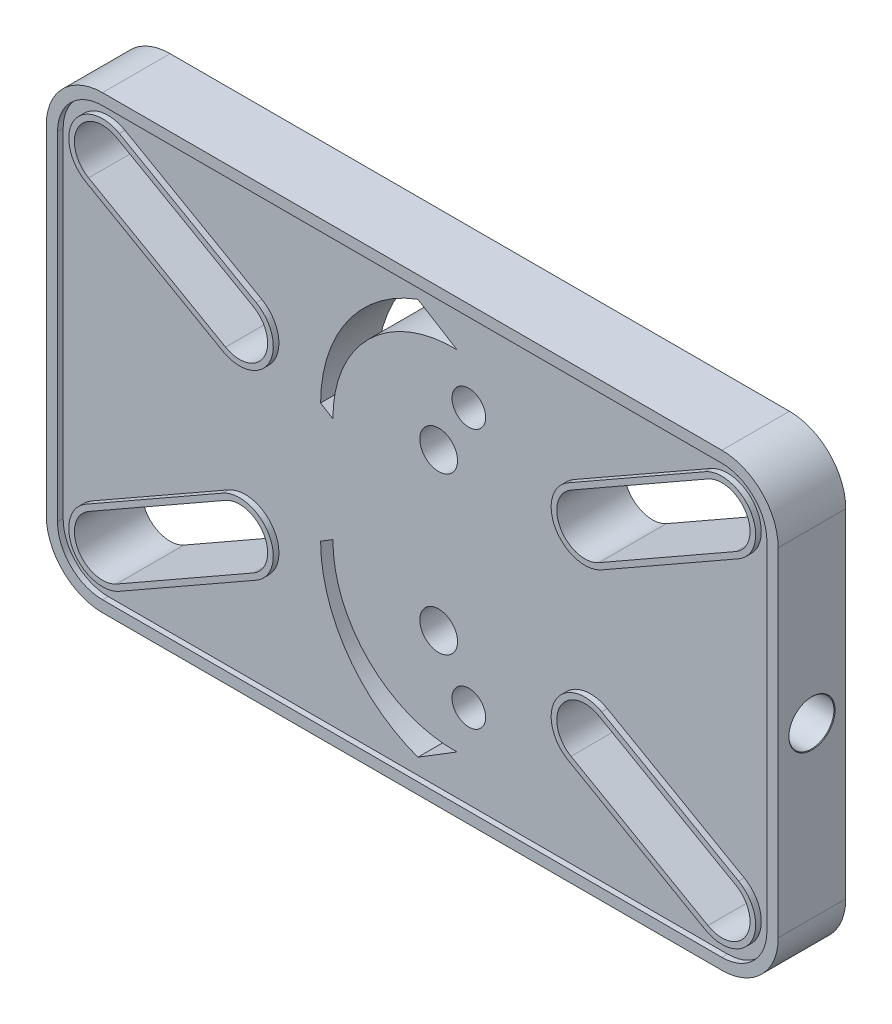
from build123d import *

# Parameters (mm, degrees)
BOSS_EXTRUDE2_DEPTH   = 3
BOSS_EXTRUDE2_2_DEPTH = 3
BOSS_EXTRUDE2_3_DEPTH = 3
BOSS_EXTRUDE2_4_DEPTH = 3
BOSS_EXTRUDE2_5_DEPTH = 3
SKETCH1_3_R           = 1.495691171
SKETCH1_3_R_2         = 1.676523608
BOSS_EXTRUDE3_DEPTH   = 2.5
SKETCH4_R             = 2
CUT_EXTRUDE5_DEPTH    = 69.0734897
CHAMFER1_SIZE         = 0.05


with BuildPart() as part:
    # Sketch1 → Boss-Extrude2 (new, symmetric)
    with BuildSketch(Plane.XY):
        with BuildLine():
            Line((27.5, 20), (-27.5, 20))
            ThreePointArc((-27.5, 20), (-31.035533906, 18.535533906), (-32.5, 15))
            Line((-32.5, 15), (-32.5, -15))
            ThreePointArc((-32.5, -15), (-31.035533906, -18.535533906), (-27.5, -20))
            Line((-27.5, -20), (27.5, -20))
            ThreePointArc((27.5, -20), (31.035533906, -18.535533906), (32.5, -15))
            Line((32.5, -15), (32.5, 15))
            ThreePointArc((32.5, 15), (31.035533906, 18.535533906), (27.5, 20))
        make_face()
        with BuildLine():
            Line((-31.5, -15), (-31.5, 15))
            ThreePointArc((-31.5, 15), (-30.328427125, 17.828427125), (-27.5, 19))
            Line((-27.5, 19), (27.5, 19))
            ThreePointArc((27.5, 19), (30.328427125, 17.828427125), (31.5, 15))
            Line((31.5, 15), (31.5, -15))
            ThreePointArc((31.5, -15), (30.328427125, -17.828427125), (27.5, -19))
            Line((27.5, -19), (-27.5, -19))
            ThreePointArc((-27.5, -19), (-30.328427125, -17.828427125), (-31.5, -15))
        make_face(mode=Mode.SUBTRACT)
    extrude(amount=BOSS_EXTRUDE2_DEPTH, both=True)



with BuildPart() as body_2:
    # Sketch1 → Boss-Extrude2 2 (new, symmetric)
    with BuildSketch(Plane.XY):
        with BuildLine():
            Line((-13.852089473, 10.671658719), (-26.014041324, 17.60613254))
            ThreePointArc((-26.014041324, 17.60613254), (-30.10613254, 16.485958676), (-28.985958676, 12.39386746))
            Line((-28.985958676, 12.39386746), (-16.824006824, 5.45939364))
            ThreePointArc((-16.824006824, 5.45939364), (-12.731915609, 6.579567504), (-13.852089473, 10.671658719))
        make_face()
        with BuildLine():
            ThreePointArc((-28.738298896, 12.828222884), (-29.671777116, 16.238298896), (-26.261701104, 17.171777116))
            Line((-26.261701104, 17.171777116), (-14.099749252, 10.237303296))
            ThreePointArc((-14.099749252, 10.237303296), (-13.166271032, 6.827227283), (-16.576347045, 5.893749063))
            Line((-16.576347045, 5.893749063), (-28.738298896, 12.828222884))
        make_face(mode=Mode.SUBTRACT)
    extrude(amount=BOSS_EXTRUDE2_2_DEPTH, both=True)


with BuildPart() as body_3:
    # Sketch1 → Boss-Extrude2 3 (new, symmetric)
    with BuildSketch(Plane.XY):
        with BuildLine():
            ThreePointArc((28.985958676, 12.39386746), (30.10613254, 16.485958676), (26.014041324, 17.60613254))
            Line((26.014041324, 17.60613254), (13.852089473, 10.671658719))
            ThreePointArc((13.852089473, 10.671658719), (12.731915609, 6.579567504), (16.824006824, 5.45939364))
            Line((16.824006824, 5.45939364), (28.985958676, 12.39386746))
        make_face()
        with BuildLine():
            Line((14.099749252, 10.237303296), (26.261701104, 17.171777116))
            ThreePointArc((26.261701104, 17.171777116), (29.671777116, 16.238298896), (28.738298896, 12.828222884))
            Line((28.738298896, 12.828222884), (16.576347045, 5.893749063))
            ThreePointArc((16.576347045, 5.893749063), (13.166271032, 6.827227283), (14.099749252, 10.237303296))
        make_face(mode=Mode.SUBTRACT)
    extrude(amount=BOSS_EXTRUDE2_3_DEPTH, both=True)


with BuildPart() as body_4:
    # Sketch1 → Boss-Extrude2 4 (new, symmetric)
    with BuildSketch(Plane.XY):
        with BuildLine():
            Line((13.852089473, -10.671658719), (26.014041324, -17.60613254))
            ThreePointArc((26.014041324, -17.60613254), (30.10613254, -16.485958676), (28.985958676, -12.39386746))
            Line((28.985958676, -12.39386746), (16.824006824, -5.45939364))
            ThreePointArc((16.824006824, -5.45939364), (12.731915609, -6.579567504), (13.852089473, -10.671658719))
        make_face()
        with BuildLine():
            ThreePointArc((28.738298896, -12.828222884), (29.671777116, -16.238298896), (26.261701104, -17.171777116))
            Line((26.261701104, -17.171777116), (14.099749252, -10.237303296))
            ThreePointArc((14.099749252, -10.237303296), (13.166271032, -6.827227283), (16.576347045, -5.893749063))
            Line((16.576347045, -5.893749063), (28.738298896, -12.828222884))
        make_face(mode=Mode.SUBTRACT)
    extrude(amount=BOSS_EXTRUDE2_4_DEPTH, both=True)


with BuildPart() as body_5:
    # Sketch1 → Boss-Extrude2 5 (new, symmetric)
    with BuildSketch(Plane.XY):
        with BuildLine():
            ThreePointArc((-28.985958676, -12.39386746), (-30.10613254, -16.485958676), (-26.014041324, -17.60613254))
            Line((-26.014041324, -17.60613254), (-13.852089473, -10.671658719))
            ThreePointArc((-13.852089473, -10.671658719), (-12.731915609, -6.579567504), (-16.824006824, -5.45939364))
            Line((-16.824006824, -5.45939364), (-28.985958676, -12.39386746))
        make_face()
        with BuildLine():
            Line((-14.099749252, -10.237303296), (-26.261701104, -17.171777116))
            ThreePointArc((-26.261701104, -17.171777116), (-29.671777116, -16.238298896), (-28.738298896, -12.828222884))
            Line((-28.738298896, -12.828222884), (-16.576347045, -5.893749063))
            ThreePointArc((-16.576347045, -5.893749063), (-13.166271032, -6.827227283), (-14.099749252, -10.237303296))
        make_face(mode=Mode.SUBTRACT)
    extrude(amount=BOSS_EXTRUDE2_5_DEPTH, both=True)


with BuildPart() as part_1:
    add(part.part)

    add(body_2.part)  # Boss-Extrude3 merges body 2

    add(body_3.part)  # Boss-Extrude3 merges body 3

    add(body_4.part)  # Boss-Extrude3 merges body 4

    add(body_5.part)  # Boss-Extrude3 merges body 5
    # Sketch1<3> → Boss-Extrude3 (add, symmetric)
    with BuildSketch(Plane.XY):
        with BuildLine():
            ThreePointArc((-27.5, 19), (-30.328427125, 17.828427125), (-31.5, 15))
            Line((-31.5, 15), (-31.5, -15))
            ThreePointArc((-31.5, -15), (-30.328427125, -17.828427125), (-27.5, -19))
            Line((-27.5, -19), (27.5, -19))
            ThreePointArc((27.5, -19), (30.328427125, -17.828427125), (31.5, -15))
            Line((31.5, -15), (31.5, 15))
            ThreePointArc((31.5, 15), (30.328427125, 17.828427125), (27.5, 19))
            Line((27.5, 19), (-27.5, 19))
        make_face()
        with BuildLine():
            Line((-13.852089473, -10.671658719), (-26.014041324, -17.60613254))
            ThreePointArc((-26.014041324, -17.60613254), (-30.10613254, -16.485958676), (-28.985958676, -12.39386746))
            Line((-28.985958676, -12.39386746), (-16.824006824, -5.45939364))
            ThreePointArc((-16.824006824, -5.45939364), (-12.731915609, -6.579567504), (-13.852089473, -10.671658719))
        make_face(mode=Mode.SUBTRACT)
        with BuildLine():
            ThreePointArc((0, -17.607662989), (-6.244508299, -12.814840409), (-8.638223432, -5.315829804))
            Line((-8.638223432, -5.315829804), (-7.540721224, -4.64044383))
            ThreePointArc((-7.540721224, -4.64044383), (-4.327491025, -12.392789568), (3.48180896, -15.465011321))
            Line((3.48180896, -15.465011321), (0, -17.607662989))
        make_face(mode=Mode.SUBTRACT)
        with Locations((4.527145443, -11.53276309)):
            Circle(SKETCH1_3_R, mode=Mode.SUBTRACT)
        with BuildLine():
            ThreePointArc((28.985958676, -12.39386746), (30.10613254, -16.485958676), (26.014041324, -17.60613254))
            Line((26.014041324, -17.60613254), (13.852089473, -10.671658719))
            ThreePointArc((13.852089473, -10.671658719), (12.731915609, -6.579567504), (16.824006824, -5.45939364))
            Line((16.824006824, -5.45939364), (28.985958676, -12.39386746))
        make_face(mode=Mode.SUBTRACT)
        with Locations((1.848455798, -6.957616723)):
            Circle(SKETCH1_3_R_2, mode=Mode.SUBTRACT)
        with BuildLine():
            ThreePointArc((-28.985958676, 12.39386746), (-30.10613254, 16.485958676), (-26.014041324, 17.60613254))
            Line((-26.014041324, 17.60613254), (-13.852089473, 10.671658719))
            ThreePointArc((-13.852089473, 10.671658719), (-12.731915609, 6.579567504), (-16.824006824, 5.45939364))
            Line((-16.824006824, 5.45939364), (-28.985958676, 12.39386746))
        make_face(mode=Mode.SUBTRACT)
        with BuildLine():
            Line((-7.540721224, 4.64044383), (-8.638223432, 5.315829804))
            ThreePointArc((-8.638223432, 5.315829804), (-6.244508299, 12.814840409), (0, 17.607662989))
            Line((0, 17.607662989), (3.48180896, 15.465011321))
            ThreePointArc((3.48180896, 15.465011321), (-4.327491025, 12.392789568), (-7.540721224, 4.64044383))
        make_face(mode=Mode.SUBTRACT)
        with Locations((1.848455798, 6.957616723)):
            Circle(SKETCH1_3_R_2, mode=Mode.SUBTRACT)
        with Locations((4.527145443, 11.53276309)):
            Circle(SKETCH1_3_R, mode=Mode.SUBTRACT)
        with BuildLine():
            Line((13.852089473, 10.671658719), (26.014041324, 17.60613254))
            ThreePointArc((26.014041324, 17.60613254), (30.10613254, 16.485958676), (28.985958676, 12.39386746))
            Line((28.985958676, 12.39386746), (16.824006824, 5.45939364))
            ThreePointArc((16.824006824, 5.45939364), (12.731915609, 6.579567504), (13.852089473, 10.671658719))
        make_face(mode=Mode.SUBTRACT)
    extrude(amount=BOSS_EXTRUDE3_DEPTH, both=True)

    # Sketch4 → Cut-Extrude5 (cut, through all)
    with BuildSketch(Plane.ZY.offset(32.5)):
        Circle(SKETCH4_R)
    extrude(amount=-CUT_EXTRUDE5_DEPTH, mode=Mode.SUBTRACT)

    # Chamfer1
    chamfer1_edges = [part_1.edges().sort_by_distance(p)[0] for p in [
        (32.5, 0, -2),
        (-32.5, 0, -2),
    ]]
    chamfer(chamfer1_edges, length=CHAMFER1_SIZE)


solid = part_1.part
